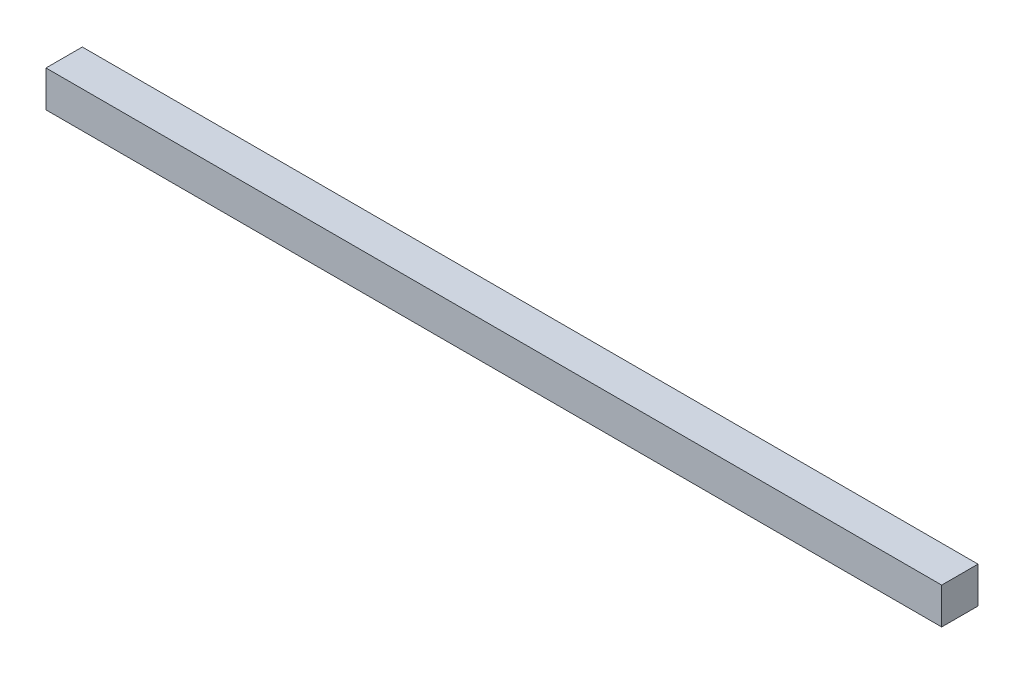
from build123d import *

# Parameters (mm, degrees)
SKETCH_1_W      = 370
SKETCH_1_H      = 15
EXTRUDE_1_DEPTH = 15


with BuildPart() as part:
    # 草图1 → 凸台-拉伸1 (new body)
    with BuildSketch(Plane(origin=(0, 0, 0), x_dir=(1, 0, 0), z_dir=(0, 1, 0))):
        Rectangle(SKETCH_1_W, SKETCH_1_H)
    extrude(amount=EXTRUDE_1_DEPTH)


solid = part.part
